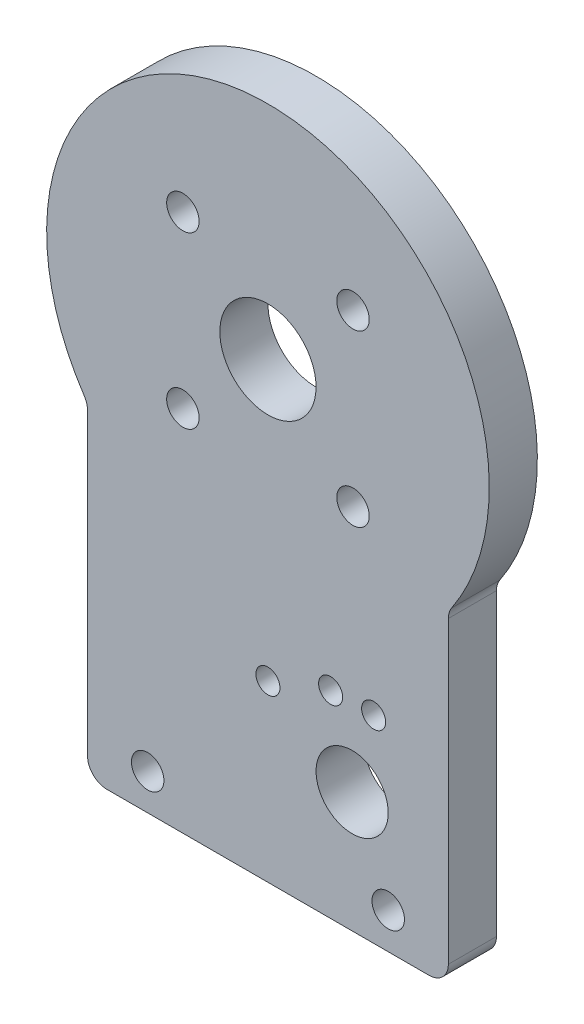
from build123d import *

# Parameters (mm, degrees)
CROQUIS1_R              = 1.35
CROQUIS1_R_2            = 4
SALIENTE_EXTRUIR1_DEPTH = 4
CROQUIS2_R              = 3
CROQUIS2_R_2            = 1
CORTAR_EXTRUIR1_DEPTH   = 4
REDONDEO1_R             = 1.6
CROQUIS3_R              = 1
CORTAR_EXTRUIR2_DEPTH   = 4


with BuildPart() as part:
    # Croquis1 → Saliente-Extruir1 (new body)
    with BuildSketch(Plane.XY):
        with BuildLine():
            Line((-15, -10.656453444), (-15, -37.656453444))
            Line((-15, -37.656453444), (15, -37.656453444))
            Line((15, -37.656453444), (15, -10.656453444))
            ThreePointArc((15, -10.656453444), (0, 18.4), (-15, -10.656453444))
        make_face()
        with Locations((-7.071067812, -7.071067812)):
            Circle(CROQUIS1_R, mode=Mode.SUBTRACT)
        with Locations((-7.071067812, 7.071067812)):
            Circle(CROQUIS1_R, mode=Mode.SUBTRACT)
        with Locations((7.071067812, 7.071067812)):
            Circle(CROQUIS1_R, mode=Mode.SUBTRACT)
        with Locations((7.071067812, -7.071067812)):
            Circle(CROQUIS1_R, mode=Mode.SUBTRACT)
        Circle(CROQUIS1_R_2, mode=Mode.SUBTRACT)
        with Locations((-10, -34.656453444)):
            Circle(CROQUIS1_R, mode=Mode.SUBTRACT)
        with Locations(Location((10, -34.656453444, 0), (0, 0, 180))):
            Circle(CROQUIS1_R, mode=Mode.SUBTRACT)
    extrude(amount=SALIENTE_EXTRUIR1_DEPTH)

    # Croquis2 → Cortar-Extruir1 (cut)
    with BuildSketch(Plane.XY.offset(4)):
        with Locations((7, -27.656453444)):
            Circle(CROQUIS2_R)
        with Locations((5.211145618, -21.234162208)):
            Circle(CROQUIS2_R_2)
        with Locations(Location((8.788854382, -21.234162208, 0), (0, 0, 180))):
            Circle(CROQUIS2_R_2)
    extrude(amount=-CORTAR_EXTRUIR1_DEPTH, mode=Mode.SUBTRACT)

    # Redondeo1
    redondeo1_edges = [part.edges().sort_by_distance(p)[0] for p in [
        (15, -10.656453444, 2),
        (15, -37.656453444, 2),
        (-15, -37.656453444, 2),
        (-15, -10.656453444, 2),
    ]]
    fillet(redondeo1_edges, radius=REDONDEO1_R)

    # Croquis3 → Cortar-Extruir2 (cut)
    with BuildSketch(Plane.XY.offset(4)):
        with Locations((0, -23.156453444)):
            Circle(CROQUIS3_R)
    extrude(amount=-CORTAR_EXTRUIR2_DEPTH, mode=Mode.SUBTRACT)


solid = part.part
